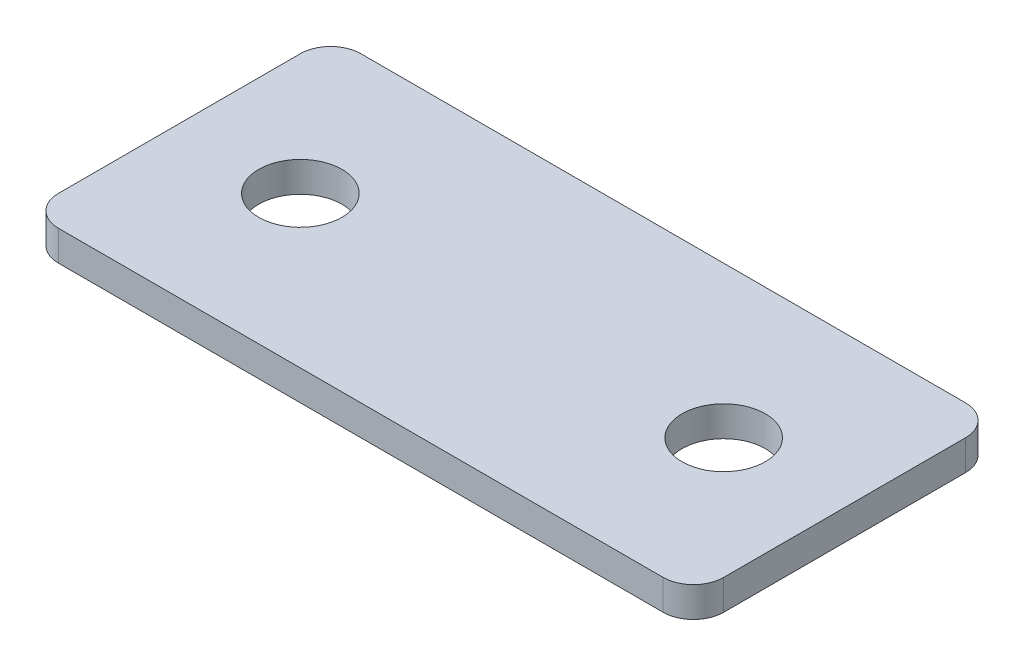
from build123d import *

# Parameters (mm, degrees)
SKETCH1_W           = 69.85
SKETCH1_H           = 31.75
SKETCH1_R           = 4.3688
BOSS_EXTRUDE1_DEPTH = 3.175
FILLET1_R           = 3.175


with BuildPart() as part:
    # Sketch1 → Boss-Extrude1 (new body)
    with BuildSketch(Plane(origin=(0, 0, 0), x_dir=(1, 0, 0), z_dir=(0, 1, 0))):
        with Locations((34.925, 15.875)):
            Rectangle(SKETCH1_W, SKETCH1_H)
        with Locations(Location((12.7, 15.875, 0), (0, 0, 270))):
            Circle(SKETCH1_R, mode=Mode.SUBTRACT)
        with Locations(Location((57.15, 15.875, 0), (0, 0, 270))):
            Circle(SKETCH1_R, mode=Mode.SUBTRACT)
    extrude(amount=BOSS_EXTRUDE1_DEPTH)

    # Fillet1
    fillet1_edges = [part.edges().sort_by_distance(p)[0] for p in [
        (0, 1.5875, -31.75),
        (69.85, 1.5875, -31.75),
        (69.85, 1.5875, 0),
        (0, 1.5875, 0),
    ]]
    fillet(fillet1_edges, radius=FILLET1_R)


solid = part.part
